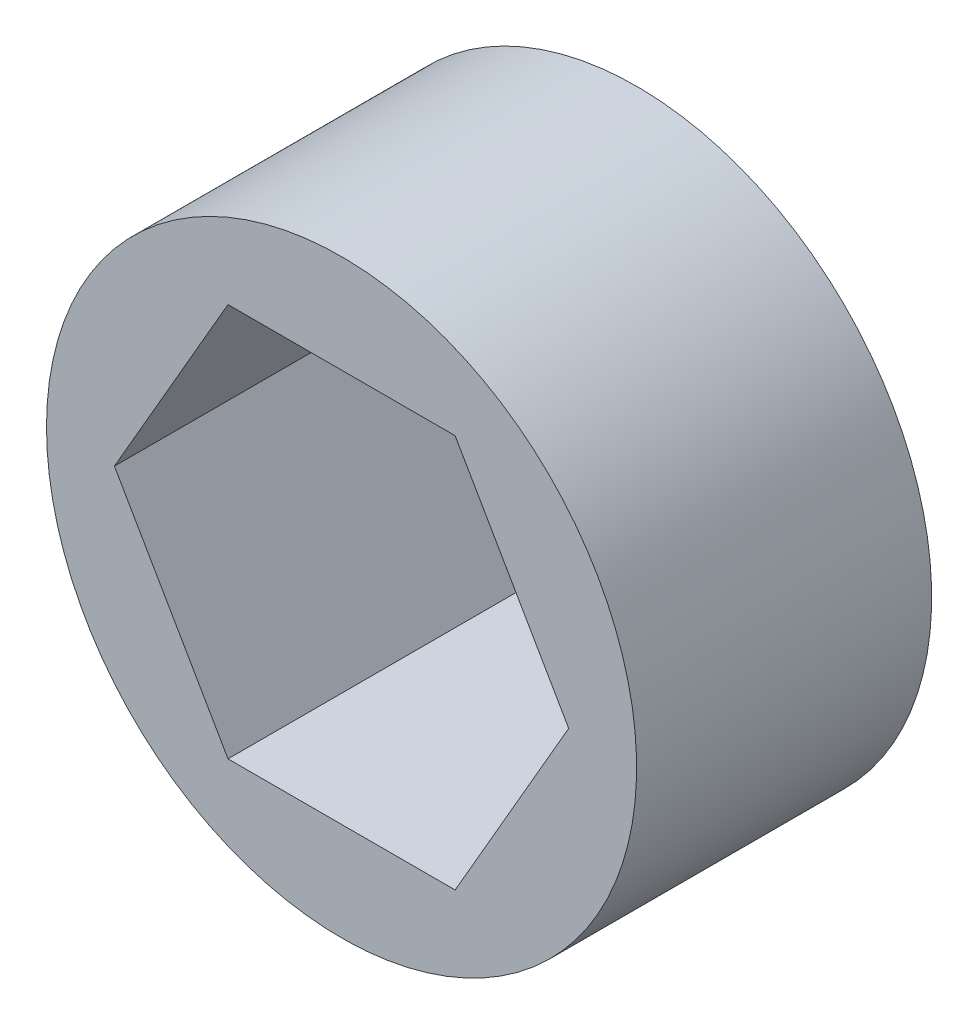
from build123d import *

# Parameters (mm, degrees)
SKETCH1_R           = 9.525
BOSS_EXTRUDE1_DEPTH = 9.525


with BuildPart() as part:
    # Sketch1 → Boss-Extrude1 (new body)
    with BuildSketch(Plane.XY):
        with Locations(Location((0, 0, 0), (0, 0, 180))):
            Circle(SKETCH1_R)
        Polygon((7.332348419, 0), (3.666174209, 6.35), (-3.666174209, 6.35), (-7.332348419, 0), (-3.666174209, -6.35), (3.666174209, -6.35), align=None, mode=Mode.SUBTRACT)
    extrude(amount=BOSS_EXTRUDE1_DEPTH)


solid = part.part
